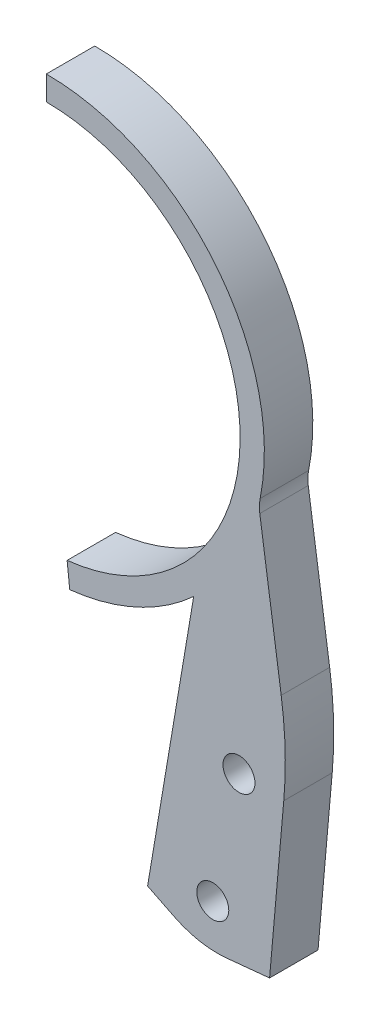
from build123d import *

# Parameters (mm, degrees)
SKETCH_1_R      = 1.65
EXTRUDE_1_DEPTH = 5
FILLET_2_R      = 4
FILLET_3_R      = 40
FILLET_4_R      = 10


with BuildPart() as part:
    # 草图1 → 凸台-拉伸1 (new body)
    with BuildSketch(Plane.XY):
        with BuildLine():
            Line((-11.5, 79.5), (-11.5, 82))
            ThreePointArc((-11.5, 82), (6.103622298, 73.512939805), (10.426977744, 54.454442843))
            Line((10.426977744, 54.454442843), (13.41461423, 33.96926032))
            Line((13.41461423, 33.96926032), (11.539893904, 12.741041785))
            Line((11.539893904, 12.741041785), (4.278741136, 12.025251419))
            Line((4.278741136, 12.025251419), (-1.047111461, 14.664575003))
            Line((-1.047111461, 14.664575003), (3.709660575, 42.919402146))
            ThreePointArc((3.709660575, 42.919402146), (-2.22232543, 39.001835337), (-9.080443962, 37.130472768))
            Line((-9.080443962, 37.130472768), (-9.349283522, 39.615975794))
            ThreePointArc((-9.349283522, 39.615975794), (8.470985005, 60.576920581), (-11.5, 79.5))
        make_face()
        with Locations((5.679475492, 16.683750627)):
            Circle(SKETCH_1_R, mode=Mode.SUBTRACT)
        with Locations((8.382327473, 29.399669437)):
            Circle(SKETCH_1_R, mode=Mode.SUBTRACT)
    extrude(amount=EXTRUDE_1_DEPTH)

    # 圆角2
    fillet_2_edges = [part.edges().sort_by_distance(p)[0] for p in [
        (10.426977744, 54.454442843, 2.5),
    ]]
    fillet(fillet_2_edges, radius=FILLET_2_R)

    # 圆角3
    fillet_3_edges = [part.edges().sort_by_distance(p)[0] for p in [
        (13.41461423, 33.96926032, 2.5),
    ]]
    fillet(fillet_3_edges, radius=FILLET_3_R)

    # 圆角4
    fillet_4_edges = [part.edges().sort_by_distance(p)[0] for p in [
        (4.278741136, 12.025251419, 2.5),
    ]]
    fillet(fillet_4_edges, radius=FILLET_4_R)


solid = part.part
